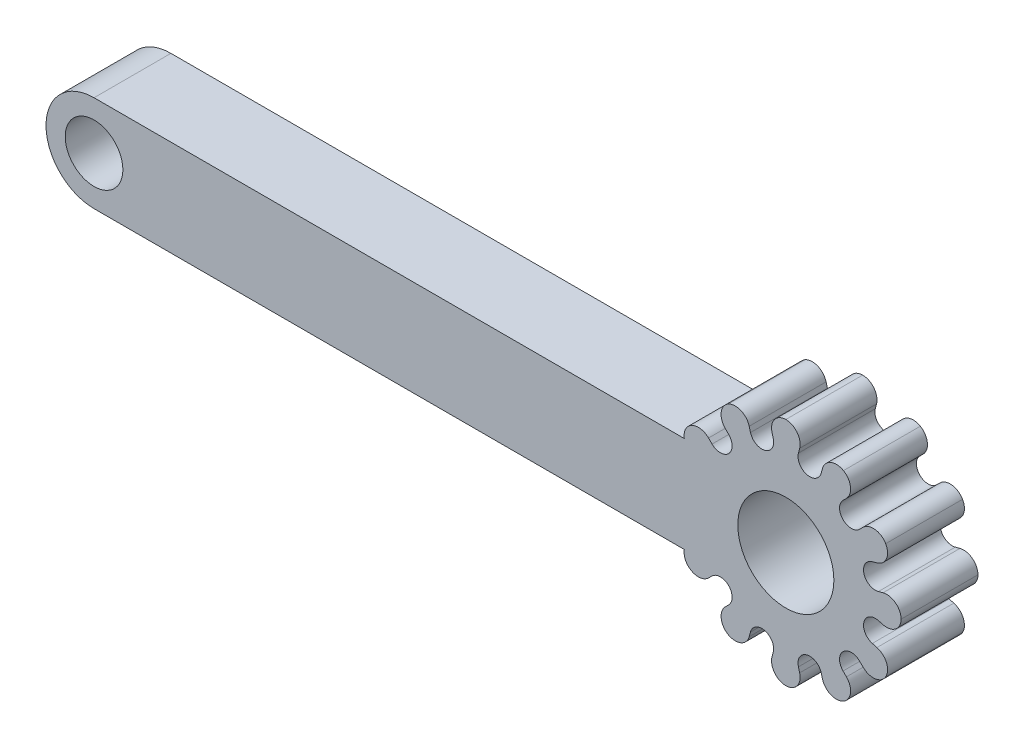
from build123d import *

# Parameters (mm, degrees)
SKETCH1_R           = 1.5
BOSS_EXTRUDE1_DEPTH = 4
CUT_EXTRUDE2_DEPTH  = 26.059928172
CIRPATTERN1_COUNT   = 12
SKETCH3_W           = 9.640063732
SKETCH3_H           = 5
BOSS_EXTRUDE6_DEPTH = 4
SKETCH4_R           = 2.5
CUT_EXTRUDE3_DEPTH  = 26.059928172


with BuildPart() as part:
    # Sketch1 → Boss-Extrude1 (new body)
    with BuildSketch(Plane.XY):
        with BuildLine():
            Line((-18, 2.5), (12.545643943, 2.5))
            ThreePointArc((12.545643943, 2.5), (24, 0), (12.545643943, -2.5))
            Line((12.545643943, -2.5), (-18, -2.5))
            ThreePointArc((-18, -2.5), (-20.5, 0), (-18, 2.5))
        make_face()
        with Locations((-18, 0)):
            Circle(SKETCH1_R, mode=Mode.SUBTRACT)
    extrude(amount=BOSS_EXTRUDE1_DEPTH)

    # Sketch2 → Cut-Extrude2 (cut, through all)
    with BuildSketch(Plane.XY.offset(4)):
        with BuildLine():
            Line((18.72, 5.06), (18.654523502, 4.81))
            ThreePointArc((18.654523502, 4.81), (19.09327028, 4.062778187), (19.840492093, 4.501524965))
            Line((19.840492093, 4.501524965), (19.906461709, 4.742088543))
            ThreePointArc((19.906461709, 4.742088543), (20.342216866, 5.236479445), (21, 5.196152423))
            ThreePointArc((21, 5.196152423), (19.568400179, 5.853349156), (18, 6))
            ThreePointArc((18, 6), (18.589879661, 5.706078038), (18.72, 5.06))
        make_face()
    cut_extrude2 = extrude(amount=-CUT_EXTRUDE2_DEPTH, mode=Mode.SUBTRACT)

    # CirPattern1: Cut-Extrude2 ×12 about axis
    cirpattern1_axis = Axis((18, 0, 0), (0, 0, 1))
    for i in range(1, CIRPATTERN1_COUNT):
        add(cut_extrude2.rotate(cirpattern1_axis, i * 360 / CIRPATTERN1_COUNT), mode=Mode.SUBTRACT)

    # Sketch3 → Boss-Extrude6 (add)
    with BuildSketch(Plane.XY.offset(4)):
        with Locations((15.25827781, 0)):
            Rectangle(SKETCH3_W, SKETCH3_H)
    extrude(amount=-BOSS_EXTRUDE6_DEPTH)

    # Sketch4 → Cut-Extrude3 (cut, through all)
    with BuildSketch(Plane.XY.offset(4)):
        with Locations((18, 0)):
            Circle(SKETCH4_R)
    extrude(amount=-CUT_EXTRUDE3_DEPTH, mode=Mode.SUBTRACT)


solid = part.part
